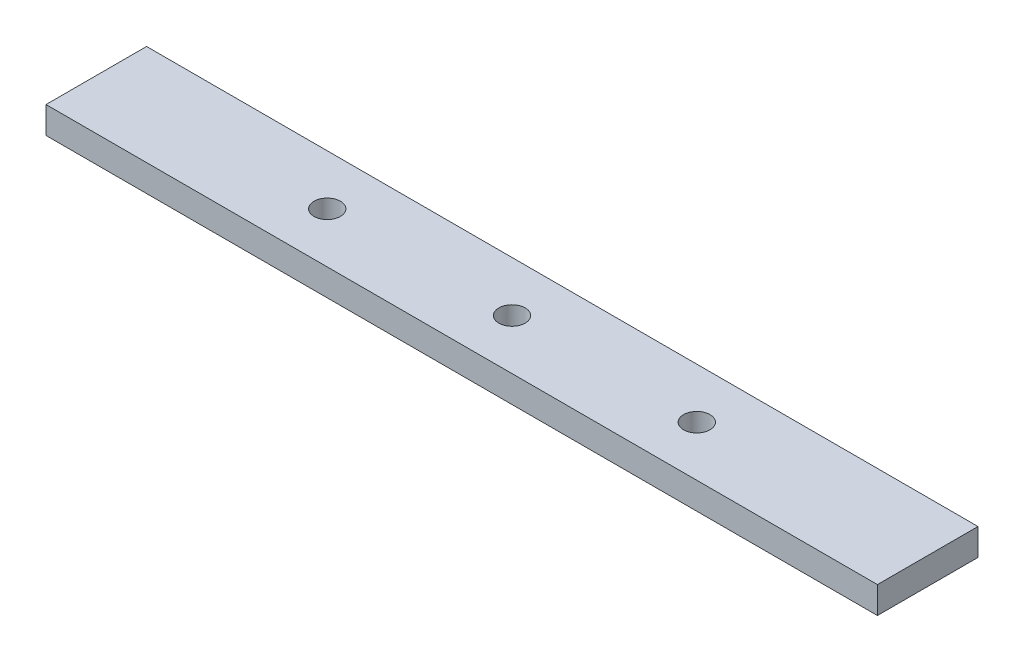
from build123d import *

# Parameters (mm, degrees)
SKETCH1_W           = 314.96
SKETCH1_H           = 38.1
BOSS_EXTRUDE1_DEPTH = 10.16
SKETCH2_R           = 5
CUT_EXTRUDE1_DEPTH  = 47.16


with BuildPart() as part:
    # Sketch1 → Boss-Extrude1 (new body)
    with BuildSketch(Plane(origin=(0, 0, 0), x_dir=(1, 0, 0), z_dir=(0, 1, 0))):
        with Locations((157.48, -19.05)):
            Rectangle(SKETCH1_W, SKETCH1_H)
    extrude(amount=BOSS_EXTRUDE1_DEPTH)

    # Sketch2 → Cut-Extrude1 (cut)
    with BuildSketch(Plane(origin=(0, 10.16, 0), x_dir=(1, 0, 0), z_dir=(0, 1, 0))):
        with Locations(Location((87.48, -19.05, 0), (0, 0, 270))):
            Circle(SKETCH2_R)
        with Locations(Location((157.48, -19.05, 0), (0, 0, 270))):
            Circle(SKETCH2_R)
        with Locations(Location((227.48, -19.05, 0), (0, 0, 270))):
            Circle(SKETCH2_R)
    extrude(amount=-CUT_EXTRUDE1_DEPTH, mode=Mode.SUBTRACT)


solid = part.part
